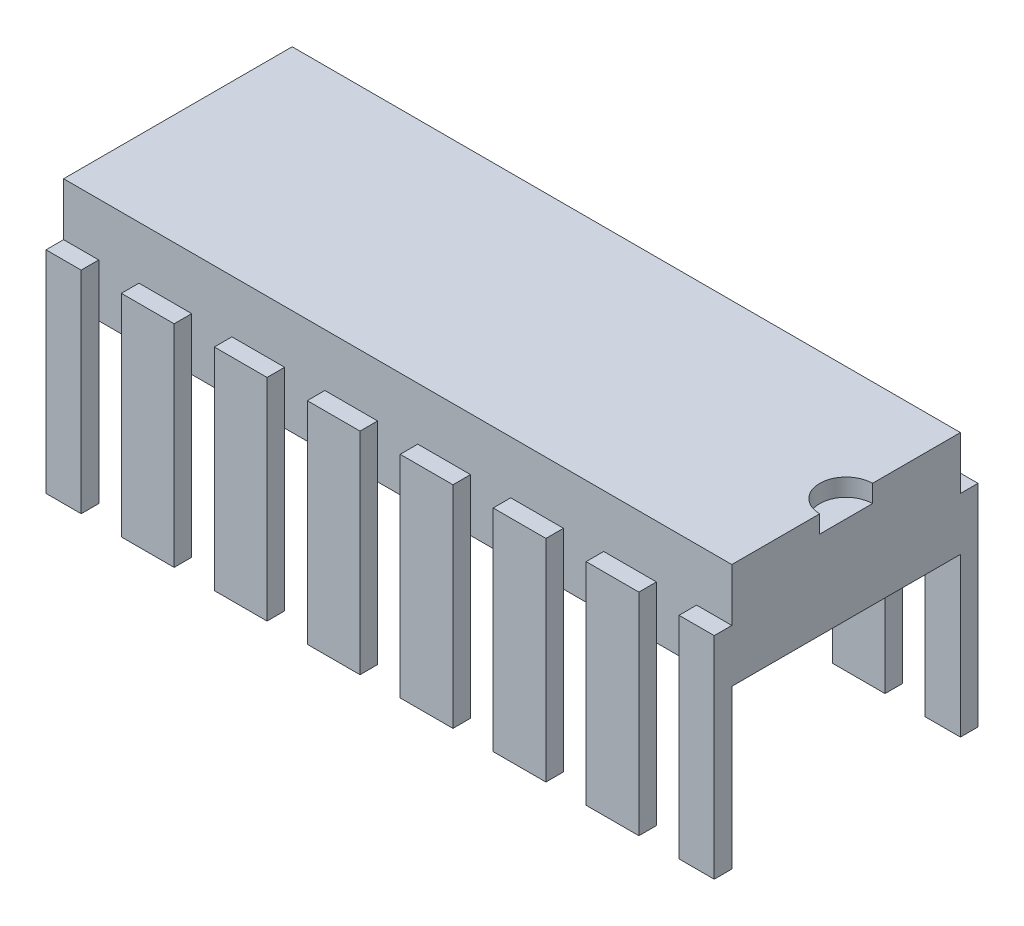
from build123d import *

# Parameters (mm, degrees)
EXTRUDE_1_DEPTH = 3
EXTRUDE_2_DEPTH = 2.5
EXTRUDE_START   = 1.5
SKETCH_1_4_W    = 1
SKETCH_1_4_H    = 0.5
SKETCH_1_4_W_2  = 1.5
EXTRUDE_3_DEPTH = 6


with BuildPart() as part:
    # Эскиз1 → Бобышка-Вытянуть1 (new body)
    with BuildSketch(Plane(origin=(0, 0, 0), x_dir=(1, 0, 0), z_dir=(0, 1, 0))):
        with BuildLine():
            Line((-8.5, 3.25), (-9.5, 3.25))
            Line((-9.5, 3.25), (-9.5, -3.25))
            Line((-9.5, -3.25), (-8.5, -3.25))
            Line((-8.5, -3.25), (-7.357142857, -3.25))
            Line((-7.357142857, -3.25), (-5.857142857, -3.25))
            Line((-5.857142857, -3.25), (-4.714285714, -3.25))
            Line((-4.714285714, -3.25), (-3.214285714, -3.25))
            Line((-3.214285714, -3.25), (-2.071428571, -3.25))
            Line((-2.071428571, -3.25), (-0.571428571, -3.25))
            Line((-0.571428571, -3.25), (0.571428571, -3.25))
            Line((0.571428571, -3.25), (2.071428571, -3.25))
            Line((2.071428571, -3.25), (3.214285714, -3.25))
            Line((3.214285714, -3.25), (4.714285714, -3.25))
            Line((4.714285714, -3.25), (5.857142857, -3.25))
            Line((5.857142857, -3.25), (7.357142857, -3.25))
            Line((7.357142857, -3.25), (8.5, -3.25))
            Line((8.5, -3.25), (9.5, -3.25))
            Line((9.5, -3.25), (9.5, -0.75))
            ThreePointArc((9.5, -0.75), (8.75, 0), (9.5, 0.75))
            Line((9.5, 0.75), (9.5, 3.25))
            Line((9.5, 3.25), (8.5, 3.25))
            Line((8.5, 3.25), (7.357142857, 3.25))
            Line((7.357142857, 3.25), (5.857142857, 3.25))
            Line((5.857142857, 3.25), (4.714285714, 3.25))
            Line((4.714285714, 3.25), (3.214285714, 3.25))
            Line((3.214285714, 3.25), (2.071428571, 3.25))
            Line((2.071428571, 3.25), (0.571428571, 3.25))
            Line((0.571428571, 3.25), (-0.571428571, 3.25))
            Line((-0.571428571, 3.25), (-2.071428571, 3.25))
            Line((-2.071428571, 3.25), (-3.214285714, 3.25))
            Line((-3.214285714, 3.25), (-4.714285714, 3.25))
            Line((-4.714285714, 3.25), (-5.857142857, 3.25))
            Line((-5.857142857, 3.25), (-7.357142857, 3.25))
            Line((-7.357142857, 3.25), (-8.5, 3.25))
        make_face()
    extrude(amount=EXTRUDE_1_DEPTH)

    # Эскиз1<3> → Бобышка-Вытянуть2 (add)
    with BuildSketch(Plane(origin=(0, 0, 0), x_dir=(1, 0, 0), z_dir=(0, 1, 0))):
        with BuildLine():
            Line((9.5, -0.75), (9.5, 0.75))
            ThreePointArc((9.5, 0.75), (8.75, 0), (9.5, -0.75))
        make_face()
    extrude(amount=EXTRUDE_2_DEPTH)

    # Эскиз1<4> → Бобышка-Вытянуть3 (add)
    with BuildSketch(Plane(origin=(0, 0, 0), x_dir=(1, 0, 0), z_dir=(0, 1, 0)).offset(EXTRUDE_START)):
        with Locations((-9, 3.5)):
            Rectangle(SKETCH_1_4_W, SKETCH_1_4_H)
        with Locations((-9, -3.5)):
            Rectangle(SKETCH_1_4_W, SKETCH_1_4_H)
        with Locations((-6.607142857, 3.5)):
            Rectangle(SKETCH_1_4_W_2, SKETCH_1_4_H)
        with Locations((-6.607142857, -3.5)):
            Rectangle(SKETCH_1_4_W_2, SKETCH_1_4_H)
        with Locations((-3.964285714, 3.5)):
            Rectangle(SKETCH_1_4_W_2, SKETCH_1_4_H)
        with Locations((-3.964285714, -3.5)):
            Rectangle(SKETCH_1_4_W_2, SKETCH_1_4_H)
        with Locations((-1.321428571, 3.5)):
            Rectangle(SKETCH_1_4_W_2, SKETCH_1_4_H)
        with Locations((-1.321428571, -3.5)):
            Rectangle(SKETCH_1_4_W_2, SKETCH_1_4_H)
        with Locations((1.321428571, 3.5)):
            Rectangle(SKETCH_1_4_W_2, SKETCH_1_4_H)
        with Locations((1.321428571, -3.5)):
            Rectangle(SKETCH_1_4_W_2, SKETCH_1_4_H)
        with Locations((3.964285714, 3.5)):
            Rectangle(SKETCH_1_4_W_2, SKETCH_1_4_H)
        with Locations((3.964285714, -3.5)):
            Rectangle(SKETCH_1_4_W_2, SKETCH_1_4_H)
        with Locations((6.607142857, 3.5)):
            Rectangle(SKETCH_1_4_W_2, SKETCH_1_4_H)
        with Locations((6.607142857, -3.5)):
            Rectangle(SKETCH_1_4_W_2, SKETCH_1_4_H)
        with Locations((9, 3.5)):
            Rectangle(SKETCH_1_4_W, SKETCH_1_4_H)
        with Locations((9, -3.5)):
            Rectangle(SKETCH_1_4_W, SKETCH_1_4_H)
    extrude(amount=-EXTRUDE_3_DEPTH)


solid = part.part
